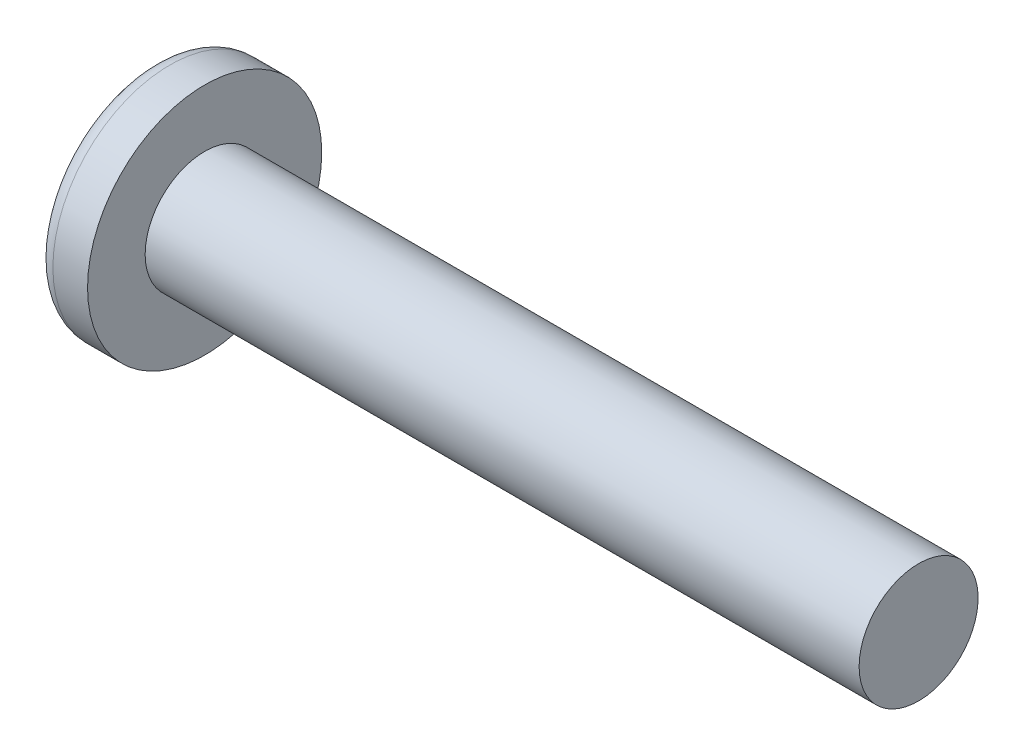
from build123d import *

# Parameters (mm, degrees)
CIRPATTERN1_COUNT = 2
CIRPATTERN1_ANGLE = 90


with BuildPart() as part:
    # BodySke → Base-Revolve (revolve)
    with BuildSketch(Plane.XY, mode=Mode.PRIVATE) as base_revolve_sk:
        with BuildLine():
            Line((4.445, 3.175), (4.445, 6.2484))
            Line((4.445, 6.2484), (2.595062945, 6.2484))
            ThreePointArc((2.595062945, 6.2484), (2.186742909, 6.149080789), (1.869658022, 5.873315068))
            ThreePointArc((1.869658022, 5.873315068), (0.478691346, 3.081860275), (0, 0))
            Line((0, 0), (42.545, 0))
            Line((42.545, 0), (42.545, 3.175))
            Line((42.545, 3.175), (4.445, 3.175))
        make_face()
    revolve(base_revolve_sk.sketch.rotate(Axis((-25.4, 0, 0), (1, 0, 0)), 90), axis=Axis((-25.4, 0, 0), (1, 0, 0)))

    # Sketch3 → Cut-Loft1 section 0
    with BuildSketch(Plane(origin=(0, 0, 0), x_dir=(0, 0, -1), z_dir=(1, 0, 0))):
        with BuildLine():
            Line((0.7366, -4.0386), (-0.7366, -4.0386))
            Line((-0.7366, -4.0386), (-0.7366, 4.0386))
            Line((-0.7366, 4.0386), (0.7366, 4.0386))
            Line((0.7366, 4.0386), (0.7366, -4.0386))
        make_face()
    # Sketch4 → Cut-Loft1 section 1
    with BuildSketch(Plane(origin=(4.572, 0, 0), x_dir=(0, 0, -1), z_dir=(1, 0, 0))):
        with BuildLine():
            Line((0.3683, -0.3683), (-0.3683, -0.3683))
            Line((-0.3683, -0.3683), (-0.3683, 0.3683))
            Line((-0.3683, 0.3683), (0.3683, 0.3683))
            Line((0.3683, 0.3683), (0.3683, -0.3683))
        make_face()
    cut_loft1 = loft(mode=Mode.SUBTRACT)

    # CirPattern1: Cut-Loft1 ×2 about axis
    cirpattern1_axis = Axis((0, 0, 0), (1, 0, 0))
    for i in range(1, CIRPATTERN1_COUNT):
        add(cut_loft1.rotate(cirpattern1_axis, i * CIRPATTERN1_ANGLE / (CIRPATTERN1_COUNT - 1)), mode=Mode.SUBTRACT)


solid = part.part
